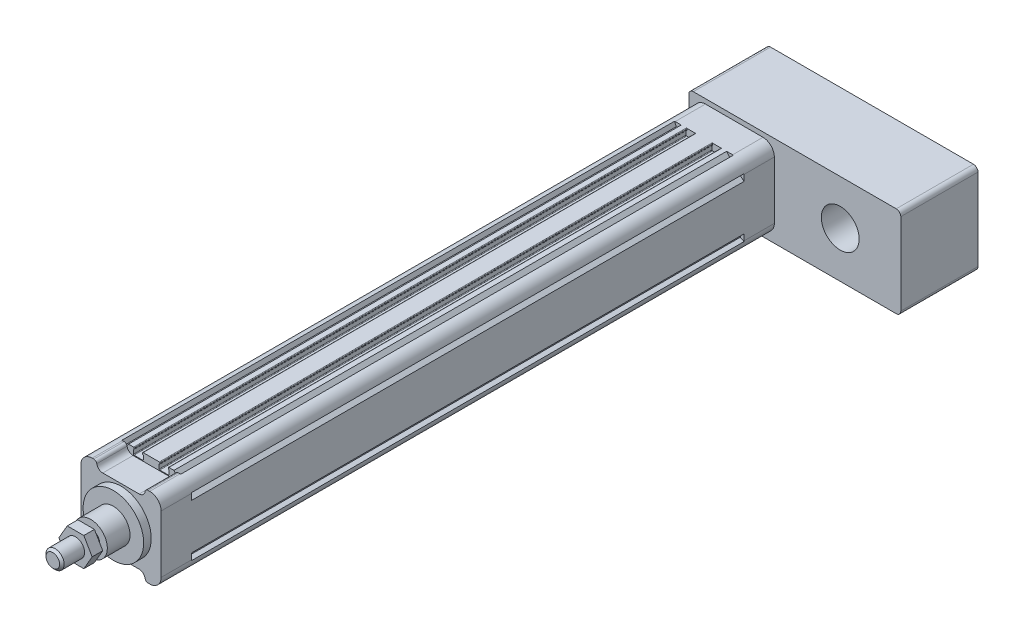
from build123d import *

# Parameters (mm, degrees)
SKETCH_1_R                  = 2.1
EXTRUDE_1_DEPTH             = 365
EXTRUDE_2_DEPTH             = 20
SKETCH_7_R                  = 20
EXTRUDE_3_DEPTH             = 5
SKETCH_9_R                  = 11
EXTRUDE_4_DEPTH             = 15
SKETCH_10_R                 = 6
EXTRUDE_5_DEPTH             = 25
EXTRUDE_START               = 20
EXTRUDE_6_DEPTH             = 20
EXTRUDE_7_DEPTH             = 51
SKETCH_13_R                 = 12.5
CUT_EXTRUDE_2_DEPTH         = 30
PATTERN_LINEAR_1_COUNT      = 2
PATTERN_LINEAR_1_PITCH      = 38
PATTERN_LINEAR_1_COUNT_DIR2 = 2
PATTERN_LINEAR_1_PITCH_DIR2 = 38
HOLE_WIZARD_M6_2_D          = 5
HOLE_WIZARD_M6_2_DEPTH      = 15
HOLE_WIZARD_M6_2_TIP        = 1.502151548
HOLE_WIZARD_M6_3_D          = 5
HOLE_WIZARD_M6_3_DEPTH      = 15
HOLE_WIZARD_M6_3_TIP        = 1.502151548
HOLE_WIZARD_M6_4_D          = 5
HOLE_WIZARD_M6_4_DEPTH      = 15
HOLE_WIZARD_M6_4_TIP        = 1.502151548
CHAMFER_1_SIZE              = 1.5
EXTRUDE_START_2             = 3
EXTRUDE_8_DEPTH             = 7


with BuildPart() as part:
    # 草图1 → 凸台-拉伸1 (new body)
    with BuildSketch(Plane.XY):
        with BuildLine():
            Line((-18.2, 24), (-19.443439638, 26.486879276))
            ThreePointArc((-19.443439638, 26.486879276), (-24.303300859, 24.303300859), (-26.486879276, 19.443439638))
            Line((-26.486879276, 19.443439638), (-24, 18.2))
            Line((-24, 18.2), (-24, 17.1))
            Line((-24, 17.1), (-26.5, 15))
            Line((-26.5, 15), (-26.5, -15))
            Line((-26.5, -15), (-24, -17.1))
            Line((-24, -17.1), (-24, -18.2))
            Line((-24, -18.2), (-26.486879276, -19.443439638))
            ThreePointArc((-26.486879276, -19.443439638), (-24.303300859, -24.303300859), (-19.443439638, -26.486879276))
            Line((-19.443439638, -26.486879276), (-18.2, -24))
            Line((-18.2, -24), (-17.1, -24))
            Line((-17.1, -24), (-15, -26.5))
            Line((-15, -26.5), (-11.65, -26.5))
            ThreePointArc((-11.65, -26.5), (-11.367157288, -26.382842712), (-11.25, -26.1))
            Line((-11.25, -26.1), (-11.25, -25.6))
            ThreePointArc((-11.25, -25.6), (-11.367157288, -25.317157288), (-11.65, -25.2))
            Line((-11.65, -25.2), (-11.75, -25.2))
            Line((-11.75, -25.2), (-11.75, -22.4))
            ThreePointArc((-11.75, -22.4), (-11.632842712, -22.117157288), (-11.35, -22))
            Line((-11.35, -22), (-5.65, -22))
            ThreePointArc((-5.65, -22), (-5.367157288, -22.117157288), (-5.25, -22.4))
            Line((-5.25, -22.4), (-5.25, -25.2))
            Line((-5.25, -25.2), (-5.35, -25.2))
            ThreePointArc((-5.35, -25.2), (-5.632842712, -25.317157288), (-5.75, -25.6))
            Line((-5.75, -25.6), (-5.75, -26.1))
            ThreePointArc((-5.75, -26.1), (-5.632842712, -26.382842712), (-5.35, -26.5))
            Line((-5.35, -26.5), (5.35, -26.5))
            ThreePointArc((5.35, -26.5), (5.632842712, -26.382842712), (5.75, -26.1))
            Line((5.75, -26.1), (5.75, -25.6))
            ThreePointArc((5.75, -25.6), (5.632842712, -25.317157288), (5.35, -25.2))
            Line((5.35, -25.2), (5.25, -25.2))
            Line((5.25, -25.2), (5.25, -22.4))
            ThreePointArc((5.25, -22.4), (5.367157288, -22.117157288), (5.65, -22))
            Line((5.65, -22), (11.35, -22))
            ThreePointArc((11.35, -22), (11.632842712, -22.117157288), (11.75, -22.4))
            Line((11.75, -22.4), (11.75, -25.2))
            Line((11.75, -25.2), (11.65, -25.2))
            ThreePointArc((11.65, -25.2), (11.367157288, -25.317157288), (11.25, -25.6))
            Line((11.25, -25.6), (11.25, -26.1))
            ThreePointArc((11.25, -26.1), (11.367157288, -26.382842712), (11.65, -26.5))
            Line((11.65, -26.5), (15, -26.5))
            Line((15, -26.5), (17.1, -24))
            Line((17.1, -24), (18.2, -24))
            Line((18.2, -24), (19.443439638, -26.486879276))
            ThreePointArc((19.443439638, -26.486879276), (24.303300859, -24.303300859), (26.486879276, -19.443439638))
            Line((26.486879276, -19.443439638), (24, -18.2))
            Line((24, -18.2), (24, -17.1))
            Line((24, -17.1), (26.5, -15))
            Line((26.5, -15), (26.5, 15))
            Line((26.5, 15), (24, 17.1))
            Line((24, 17.1), (24, 18.2))
            Line((24, 18.2), (26.486879276, 19.443439638))
            ThreePointArc((26.486879276, 19.443439638), (24.303300859, 24.303300859), (19.443439638, 26.486879276))
            Line((19.443439638, 26.486879276), (18.2, 24))
            Line((18.2, 24), (17.1, 24))
            Line((17.1, 24), (15, 26.5))
            Line((15, 26.5), (11.65, 26.5))
            ThreePointArc((11.65, 26.5), (11.367157288, 26.382842712), (11.25, 26.1))
            Line((11.25, 26.1), (11.25, 25.6))
            ThreePointArc((11.25, 25.6), (11.367157288, 25.317157288), (11.65, 25.2))
            Line((11.65, 25.2), (11.75, 25.2))
            Line((11.75, 25.2), (11.75, 22.4))
            ThreePointArc((11.75, 22.4), (11.632842712, 22.117157288), (11.35, 22))
            Line((11.35, 22), (5.65, 22))
            ThreePointArc((5.65, 22), (5.367157288, 22.117157288), (5.25, 22.4))
            Line((5.25, 22.4), (5.25, 25.2))
            Line((5.25, 25.2), (5.35, 25.2))
            ThreePointArc((5.35, 25.2), (5.632842712, 25.317157288), (5.75, 25.6))
            Line((5.75, 25.6), (5.75, 26.1))
            ThreePointArc((5.75, 26.1), (5.632842712, 26.382842712), (5.35, 26.5))
            Line((5.35, 26.5), (-5.35, 26.5))
            ThreePointArc((-5.35, 26.5), (-5.632842712, 26.382842712), (-5.75, 26.1))
            Line((-5.75, 26.1), (-5.75, 25.6))
            ThreePointArc((-5.75, 25.6), (-5.632842712, 25.317157288), (-5.35, 25.2))
            Line((-5.35, 25.2), (-5.25, 25.2))
            Line((-5.25, 25.2), (-5.25, 22.4))
            ThreePointArc((-5.25, 22.4), (-5.367157288, 22.117157288), (-5.65, 22))
            Line((-5.65, 22), (-11.35, 22))
            ThreePointArc((-11.35, 22), (-11.632842712, 22.117157288), (-11.75, 22.4))
            Line((-11.75, 22.4), (-11.75, 25.2))
            Line((-11.75, 25.2), (-11.65, 25.2))
            ThreePointArc((-11.65, 25.2), (-11.367157288, 25.317157288), (-11.25, 25.6))
            Line((-11.25, 25.6), (-11.25, 26.1))
            ThreePointArc((-11.25, 26.1), (-11.367157288, 26.382842712), (-11.65, 26.5))
            Line((-11.65, 26.5), (-15, 26.5))
            Line((-15, 26.5), (-17.1, 24))
            Line((-17.1, 24), (-18.2, 24))
        make_face()
        with Locations(Location((19, 19, 0), (0, 0, 180))):
            Circle(SKETCH_1_R, mode=Mode.SUBTRACT)
        with Locations(Location((19, -19, 0), (0, 0, 180))):
            Circle(SKETCH_1_R, mode=Mode.SUBTRACT)
        with Locations(Location((-19, -19, 0), (0, 0, 180))):
            Circle(SKETCH_1_R, mode=Mode.SUBTRACT)
        with Locations(Location((-19, 19, 0), (0, 0, 180))):
            Circle(SKETCH_1_R, mode=Mode.SUBTRACT)
        with BuildLine():
            Line((19.773719933, 3), (23.3, 3))
            Line((23.3, 3), (23.3, -3))
            Line((23.3, -3), (19.773719933, -3))
            ThreePointArc((19.773719933, -3), (0, -20), (-19.773719933, -3))
            Line((-19.773719933, -3), (-23.3, -3))
            Line((-23.3, -3), (-23.3, 3))
            Line((-23.3, 3), (-19.773719933, 3))
            ThreePointArc((-19.773719933, 3), (0, 20), (19.773719933, 3))
        make_face(mode=Mode.SUBTRACT)
    extrude(amount=EXTRUDE_1_DEPTH)

    # 草图6 → 凸台-拉伸2 (add)
    with BuildSketch(Plane.XY.offset(365)):
        with BuildLine():
            Line((-26.5, -19), (-26.5, 19))
            ThreePointArc((-26.5, 19), (-24.303300859, 24.303300859), (-19, 26.5))
            Line((-19, 26.5), (-17.916079783, 26.5))
            ThreePointArc((-17.916079783, 26.5), (-16.625085334, 26.027525232), (-15.944053189, 24.833333333))
            ThreePointArc((-15.944053189, 24.833333333), (-14.581988897, 22.444949537), (-12, 21.5))
            Line((-12, 21.5), (12, 21.5))
            ThreePointArc((12, 21.5), (14.581988897, 22.444949537), (15.944053189, 24.833333333))
            ThreePointArc((15.944053189, 24.833333333), (16.625085334, 26.027525232), (17.916079783, 26.5))
            Line((17.916079783, 26.5), (19, 26.5))
            ThreePointArc((19, 26.5), (24.303300859, 24.303300859), (26.5, 19))
            Line((26.5, 19), (26.5, -19))
            ThreePointArc((26.5, -19), (24.303300859, -24.303300859), (19, -26.5))
            Line((19, -26.5), (17.916079783, -26.5))
            ThreePointArc((17.916079783, -26.5), (16.625085334, -26.027525232), (15.944053189, -24.833333333))
            ThreePointArc((15.944053189, -24.833333333), (14.581988897, -22.444949537), (12, -21.5))
            Line((12, -21.5), (-12, -21.5))
            ThreePointArc((-12, -21.5), (-14.581988897, -22.444949537), (-15.944053189, -24.833333333))
            ThreePointArc((-15.944053189, -24.833333333), (-16.625085334, -26.027525232), (-17.916079783, -26.5))
            Line((-17.916079783, -26.5), (-19, -26.5))
            ThreePointArc((-19, -26.5), (-24.303300859, -24.303300859), (-26.5, -19))
        make_face()
    extrude(amount=EXTRUDE_2_DEPTH)

    # 草图7 → 凸台-拉伸3 (add)
    with BuildSketch(Plane.XY.offset(385)):
        Circle(SKETCH_7_R)
    extrude(amount=EXTRUDE_3_DEPTH)

    # 草图9 → 凸台-拉伸4 (add)
    with BuildSketch(Plane.XY.offset(390)):
        Circle(SKETCH_9_R)
    extrude(amount=EXTRUDE_4_DEPTH)

    # 草图10 → 凸台-拉伸5 (add)
    with BuildSketch(Plane.XY.offset(405)):
        Circle(SKETCH_10_R)
    extrude(amount=EXTRUDE_5_DEPTH)

    # 草图11 → 凸台-拉伸6 (add)
    with BuildSketch(Plane(origin=(0, 0, 0), x_dir=(-1, 0, 0), z_dir=(0, 0, -1)).offset(EXTRUDE_START)):
        with BuildLine():
            Line((-19, -26.5), (19, -26.5))
            ThreePointArc((19, -26.5), (24.303300859, -24.303300859), (26.5, -19))
            Line((26.5, -19), (26.5, 19))
            ThreePointArc((26.5, 19), (24.303300859, 24.303300859), (19, 26.5))
            Line((19, 26.5), (-19, 26.5))
            ThreePointArc((-19, 26.5), (-24.303300859, 24.303300859), (-26.5, 19))
            Line((-26.5, 19), (-26.5, -19))
            ThreePointArc((-26.5, -19), (-24.303300859, -24.303300859), (-19, -26.5))
        make_face()
    extrude(amount=-EXTRUDE_6_DEPTH)

    # 草图12 → 凸台-拉伸7 (add)
    with BuildSketch(Plane(origin=(0, 0, -20), x_dir=(-1, 0, 0), z_dir=(0, 0, -1))):
        with BuildLine():
            Line((-107, -30.404162038), (27, -30.404162038))
            ThreePointArc((27, -30.404162038), (29.121320344, -29.525482382), (30, -27.404162038))
            Line((30, -27.404162038), (30, 26.595837962))
            ThreePointArc((30, 26.595837962), (29.121320344, 28.717158305), (27, 29.595837962))
            Line((27, 29.595837962), (-107, 29.595837962))
            ThreePointArc((-107, 29.595837962), (-109.121320344, 28.717158305), (-110, 26.595837962))
            Line((-110, 26.595837962), (-110, -27.404162038))
            ThreePointArc((-110, -27.404162038), (-109.121320344, -29.525482382), (-107, -30.404162038))
        make_face()
    extrude(amount=EXTRUDE_7_DEPTH)

    # 草图13 → 切除-拉伸2 (cut)
    with BuildSketch(Plane.XY.offset(-20)):
        with Locations((70, 0)):
            Circle(SKETCH_13_R)
    extrude(amount=-CUT_EXTRUDE_2_DEPTH, mode=Mode.SUBTRACT)

    # 草图15 → M6 螺纹孔1 (revolve, cut)
    with BuildSketch(Plane(origin=(-19, -19, -71), x_dir=(0, 1, 0), z_dir=(1, 0, 0))):
        Polygon((0, 0), (0, 16.502151548), (2.5, 15), (2.5, 0), align=None)
    hole_wizard_m6_1 = revolve(axis=Axis((-19, -19, -77.35), (0, 0, 1)), mode=Mode.SUBTRACT)

    # 阵列(线性)1: Hole Wizard M6 _1 2 × 2
    with Locations(*[(j * PATTERN_LINEAR_1_PITCH_DIR2, i * PATTERN_LINEAR_1_PITCH, 0) for i in range(PATTERN_LINEAR_1_COUNT) for j in range(PATTERN_LINEAR_1_COUNT_DIR2) if (i, j) != (0, 0)]):
        add(hole_wizard_m6_1, mode=Mode.SUBTRACT)

    # M6 螺纹孔2
    with Locations(Plane(origin=(0, 0, -71), x_dir=(-1, 0, 0), z_dir=(0, 0, -1))):
        with Locations((-84, -19), (-84, 19)):
            Hole(HOLE_WIZARD_M6_2_D / 2, depth=HOLE_WIZARD_M6_2_DEPTH)
            with Locations((0, 0, -(HOLE_WIZARD_M6_2_DEPTH + HOLE_WIZARD_M6_2_TIP / 2))):  # 118° drill point
                Cone(0, HOLE_WIZARD_M6_2_D / 2, HOLE_WIZARD_M6_2_TIP, mode=Mode.SUBTRACT)

    # M6 螺纹孔3
    with Locations(Plane.ZY.offset(26.5)):
        with Locations((375, 11), (375, -11)):
            Hole(HOLE_WIZARD_M6_3_D / 2, depth=HOLE_WIZARD_M6_3_DEPTH)
            with Locations((0, 0, -(HOLE_WIZARD_M6_3_DEPTH + HOLE_WIZARD_M6_3_TIP / 2))):  # 118° drill point
                Cone(0, HOLE_WIZARD_M6_3_D / 2, HOLE_WIZARD_M6_3_TIP, mode=Mode.SUBTRACT)

    # M6 螺纹孔4
    with Locations(Plane.ZY.offset(26.5)):
        with Locations((-10, 11), (-10, -11)):
            Hole(HOLE_WIZARD_M6_4_D / 2, depth=HOLE_WIZARD_M6_4_DEPTH)
            with Locations((0, 0, -(HOLE_WIZARD_M6_4_DEPTH + HOLE_WIZARD_M6_4_TIP / 2))):  # 118° drill point
                Cone(0, HOLE_WIZARD_M6_4_D / 2, HOLE_WIZARD_M6_4_TIP, mode=Mode.SUBTRACT)

    # 倒角1
    chamfer_1_edges = [part.edges().sort_by_distance(p)[0] for p in [
        (-6, 0, 430),
    ]]
    chamfer(chamfer_1_edges, length=CHAMFER_1_SIZE)

    # 草图23 → 凸台-拉伸8 (add)
    with BuildSketch(Plane.XY.offset(405).offset(EXTRUDE_START_2)):
        Polygon((10.969655115, 0), (5.484827557, 9.5), (-5.484827557, 9.5), (-10.969655115, 0), (-5.484827557, -9.5), (5.484827557, -9.5), align=None)
    extrude(amount=EXTRUDE_8_DEPTH)


solid = part.part
